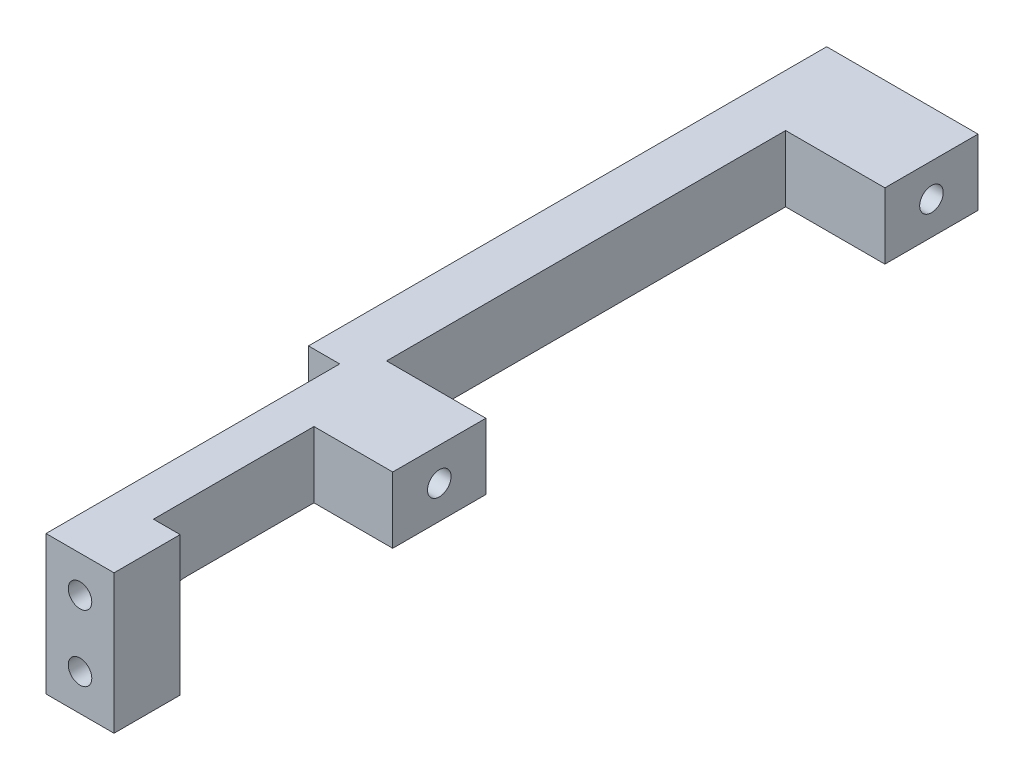
from build123d import *

# Parameters (mm, degrees)
SKETCH1_W                 = 11.5344
SKETCH1_H                 = 77.978
BOSS_EXTRUDE1_DEPTH       = 6.35
F_4_40_TAPPED_HOLE1_D     = 2.2606
F_4_40_TAPPED_HOLE1_DEPTH = 6.35
F_4_40_TAPPED_HOLE1_TIP   = 0.679152758
SKETCH2_W                 = 9.5344
SKETCH2_H                 = 38.3286
SKETCH2_W_2               = 7.56565
SKETCH2_H_2               = 15.4178
CUT_EXTRUDE1_DEPTH        = 40.921488159
SKETCH8_W                 = 5
SKETCH8_H                 = 6.35
CUT_EXTRUDE2_DEPTH        = 40.921488159
SKETCH9_W                 = 6.5344
SKETCH9_H                 = 7
BOSS_EXTRUDE2_DEPTH       = 6.35
F_4_40_TAPPED_HOLE2_D     = 2.2606
F_4_40_TAPPED_HOLE2_DEPTH = 5
F_4_40_TAPPED_HOLE2_TIP   = 0.679152758
SKETCH10_W                = 3
SKETCH10_H                = 49.7694
BOSS_EXTRUDE3_DEPTH       = 6.35
FILLET1_R                 = 3.175


with BuildPart() as part:
    # Sketch1 → Boss-Extrude1 (new body)
    with BuildSketch(Plane(origin=(0, 0, 0), x_dir=(1, 0, 0), z_dir=(0, 1, 0))):
        Rectangle(SKETCH1_W, SKETCH1_H)
    extrude(amount=BOSS_EXTRUDE1_DEPTH)

    # #4-40 Tapped Hole1
    with Locations(Plane(origin=(5.7672, 0, 0), x_dir=(0, 0, -1), z_dir=(1, 0, 0))):
        with Locations((34.5186, 3.175), (-12.7508, 3.175)):
            Hole(F_4_40_TAPPED_HOLE1_D / 2, depth=F_4_40_TAPPED_HOLE1_DEPTH)
            with Locations((0, 0, -(F_4_40_TAPPED_HOLE1_DEPTH + F_4_40_TAPPED_HOLE1_TIP / 2))):  # 118° drill point
                Cone(0, F_4_40_TAPPED_HOLE1_D / 2, F_4_40_TAPPED_HOLE1_TIP, mode=Mode.SUBTRACT)

    # Sketch2 → Cut-Extrude1 (cut, through all)
    with BuildSketch(Plane(origin=(0, 6.35, 0), x_dir=(1, 0, 0), z_dir=(0, 1, 0))):
        with Locations((1, 10.8839)):
            Rectangle(SKETCH2_W, SKETCH2_H)
        with Locations((1.984375, -24.9301)):
            Rectangle(SKETCH2_W_2, SKETCH2_H_2)
    extrude(amount=-CUT_EXTRUDE1_DEPTH, mode=Mode.SUBTRACT)

    # Sketch8 → Cut-Extrude2 (cut, through all)
    with BuildSketch(Plane(origin=(0, 6.35, 0), x_dir=(1, 0, 0), z_dir=(0, 1, 0))):
        with Locations((3.2672, -35.814)):
            Rectangle(SKETCH8_W, SKETCH8_H)
    extrude(amount=-CUT_EXTRUDE2_DEPTH, mode=Mode.SUBTRACT)

    # Sketch9 → Boss-Extrude2 (add)
    with BuildSketch(Plane.XY.offset(38.989)):
        with Locations((-2.5, -3.5)):
            Rectangle(SKETCH9_W, SKETCH9_H)
    extrude(amount=-BOSS_EXTRUDE2_DEPTH)

    # #4-40 Tapped Hole2
    with Locations(Plane.XY.offset(38.989)):
        with Locations((-2.5, 2.85), (-2.5, -3.5)):
            Hole(F_4_40_TAPPED_HOLE2_D / 2, depth=F_4_40_TAPPED_HOLE2_DEPTH)
            with Locations((0, 0, -(F_4_40_TAPPED_HOLE2_DEPTH + F_4_40_TAPPED_HOLE2_TIP / 2))):  # 118° drill point
                Cone(0, F_4_40_TAPPED_HOLE2_D / 2, F_4_40_TAPPED_HOLE2_TIP, mode=Mode.SUBTRACT)

    # Sketch10 → Boss-Extrude3 (add)
    with BuildSketch(Plane.XZ):
        with Locations((-7.2672, -14.1043)):
            Rectangle(SKETCH10_W, SKETCH10_H)
    extrude(amount=-BOSS_EXTRUDE3_DEPTH)

    # Fillet1
    fillet1_edges = [part.edges().sort_by_distance(p)[0] for p in [
        (-3.782825, 0, 32.639),
    ]]
    fillet(fillet1_edges, radius=FILLET1_R)


solid = part.part
